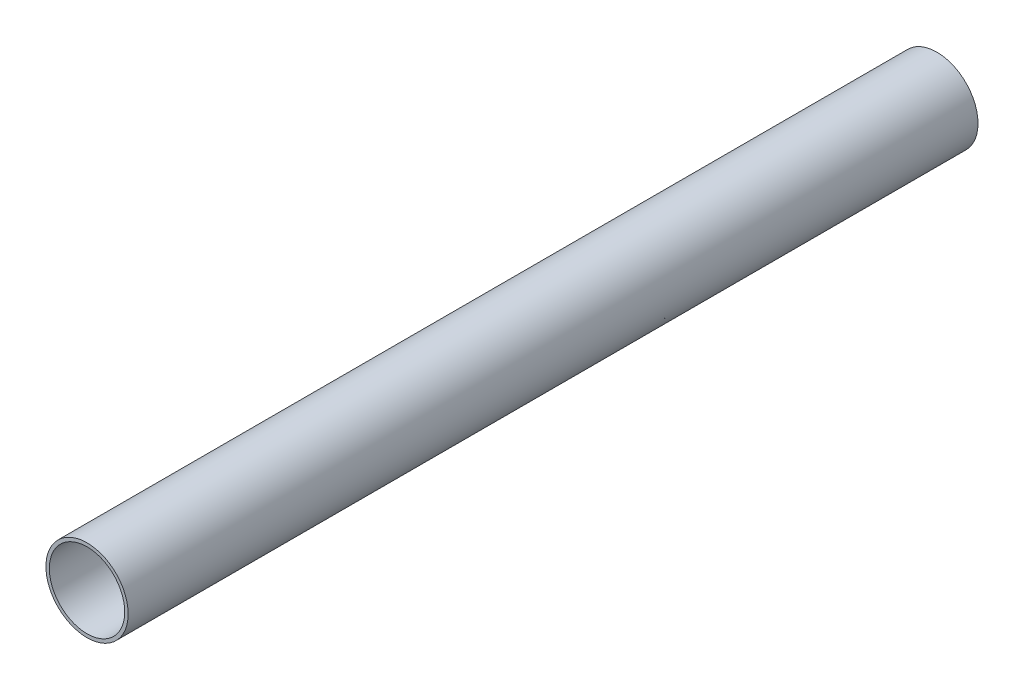
from build123d import *

# Parameters (mm, degrees)
SKETCH_1_R          = 3
EXTRUDE_1_DEPTH     = 62
SKETCH_2_R          = 2.75
CUT_EXTRUDE_1_DEPTH = 75


with BuildPart() as part:
    # 草图1 → 凸台-拉伸1 (new body)
    with BuildSketch(Plane.XY):
        Circle(SKETCH_1_R)
    extrude(amount=EXTRUDE_1_DEPTH)

    # 草图2 → 切除-拉伸1 (cut)
    with BuildSketch(Plane(origin=(0, 0, 0), x_dir=(-1, 0, 0), z_dir=(0, 0, -1))):
        Circle(SKETCH_2_R)
    extrude(amount=-CUT_EXTRUDE_1_DEPTH, mode=Mode.SUBTRACT)


solid = part.part
